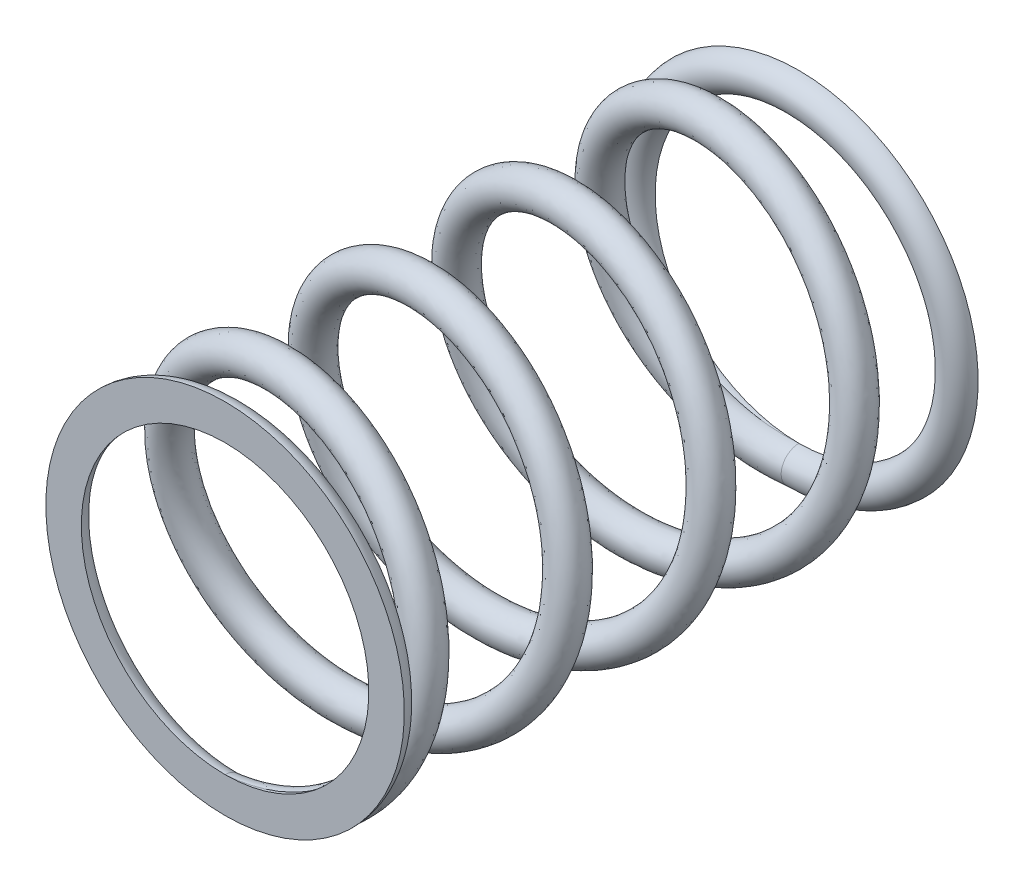
from build123d import *
from build123d.topology import SkipClean

# Parameters (mm, degrees)
SWEEP1_PITCH                  = 4.042102825
SWEEP1_HEIGHT                 = 16.1684113
SWEEP1_RADIUS                 = 4.55
SWEEP1_START_ANGLE            = -90
SCHIZZO19_R                   = 0.5
SCHIZZO17_R                   = 0.5
SCHIZZO18_R                   = 0.5
TAGLIO_ESTRUSIONE1_DEPTH      = 19.133972003
TAGLIO_ESTRUSIONE1_DEPTH_BACK = 19.133972003
SCHIZZO23_W                   = 10.1
SCHIZZO23_H                   = 0.5


with BuildPart() as part:
    # Sweep1: sweep along a helix
    with BuildLine() as sweep1_path:
        add(Helix(SWEEP1_PITCH, SWEEP1_HEIGHT, SWEEP1_RADIUS, center=(0, 0, 0), direction=(0, 0, 1), lefthand=True, mode=Mode.PRIVATE).rotate(Axis((0, 0, 0), (0, 0, 1)), SWEEP1_START_ANGLE))
    # Schizzo19 → Sweep1 (sweep)
    with BuildSketch(Plane(origin=(0, 0, 0), x_dir=(0, 0, -1), z_dir=(1, 0, 0))):
        with Locations((0, -4.55)):
            Circle(SCHIZZO19_R)
    sweep(path=sweep1_path.line, is_frenet=True)

    # Schizzo17 → Rivoluzione3 (revolve)
    with SkipClean():  # the faces are left unmerged after this step: merging them gives an invalid solid
        with BuildSketch(Plane.ZY, mode=Mode.PRIVATE) as rivoluzione3_sk:
            with Locations((16.1684113, -4.55)):
                Circle(SCHIZZO17_R)
        revolve(rivoluzione3_sk.sketch.rotate(Axis((0, 0, -1000), (0, 0, 1)), 270), axis=Axis((0, 0, -1000), (0, 0, 1)))

    # Schizzo18 → Rivoluzione4 (revolve)
    with SkipClean():  # the faces are left unmerged after this step: merging them gives an invalid solid
        with BuildSketch(Plane(origin=(0, 0, 0), x_dir=(0, 0, -1), z_dir=(1, 0, 0)), mode=Mode.PRIVATE) as rivoluzione4_sk:
            with Locations((0, -4.55)):
                Circle(SCHIZZO18_R)
        revolve(rivoluzione4_sk.sketch.rotate(Axis((0, 0, 1000), (0, 0, -1)), 270), axis=Axis((0, 0, 1000), (0, 0, -1)))

    # Schizzo23 → Taglio-Estrusione1 (cut, two sides: drawn at the far end of the back side and taken through both)
    with BuildSketch(Plane(origin=(0, 0, 0), x_dir=(1, 0, 0), z_dir=(0, 1, 0)).offset(-TAGLIO_ESTRUSIONE1_DEPTH_BACK)):
        with Locations((0, 0.25)):
            Rectangle(SCHIZZO23_W, SCHIZZO23_H)
        with Locations((0, -16.4184113)):
            Rectangle(SCHIZZO23_W, SCHIZZO23_H)
    extrude(amount=TAGLIO_ESTRUSIONE1_DEPTH + TAGLIO_ESTRUSIONE1_DEPTH_BACK, mode=Mode.SUBTRACT)


solid = part.part
